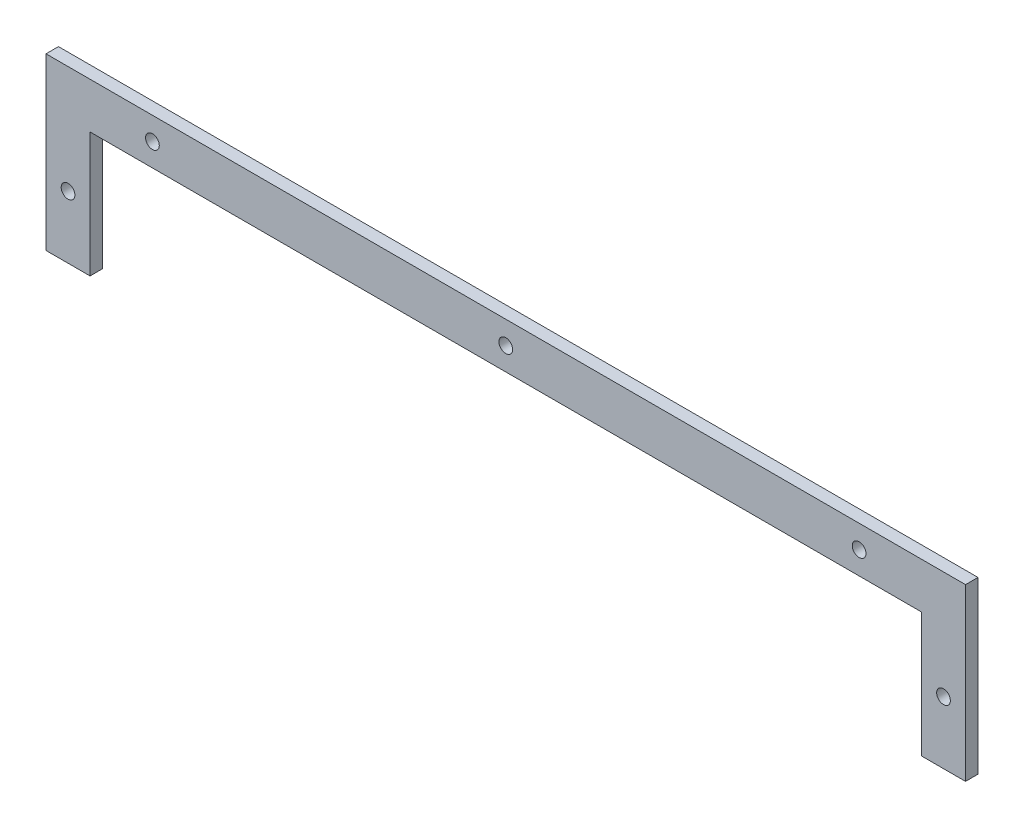
from build123d import *

# Parameters (mm, degrees)
CROQUIS1_R              = 1.65
SALIENTE_EXTRUIR1_DEPTH = 3


with BuildPart() as part:
    # Croquis1 → Saliente-Extruir1 (new body)
    with BuildSketch(Plane.XY):
        Polygon((76.151803136, 236.850888729), (65.549881, 236.850888729), (65.549881, 277.83340256), (286.749988794, 277.845112205), (286.750207376, 236.850888729), (276.149988174, 236.850888729), (276.149988174, 266.850888729), (76.151803136, 266.850888729), align=None)
        with Locations((70.850842068, 251.850888729)):
            Circle(CROQUIS1_R, mode=Mode.SUBTRACT)
        with Locations((91.151803136, 272.342426261)):
            Circle(CROQUIS1_R, mode=Mode.SUBTRACT)
        with Locations((176.149949567, 272.342426261)):
            Circle(CROQUIS1_R, mode=Mode.SUBTRACT)
        with Locations((261.148095998, 272.342426261)):
            Circle(CROQUIS1_R, mode=Mode.SUBTRACT)
        with Locations((281.449057067, 251.850888729)):
            Circle(CROQUIS1_R, mode=Mode.SUBTRACT)
    extrude(amount=SALIENTE_EXTRUIR1_DEPTH)


solid = part.part
